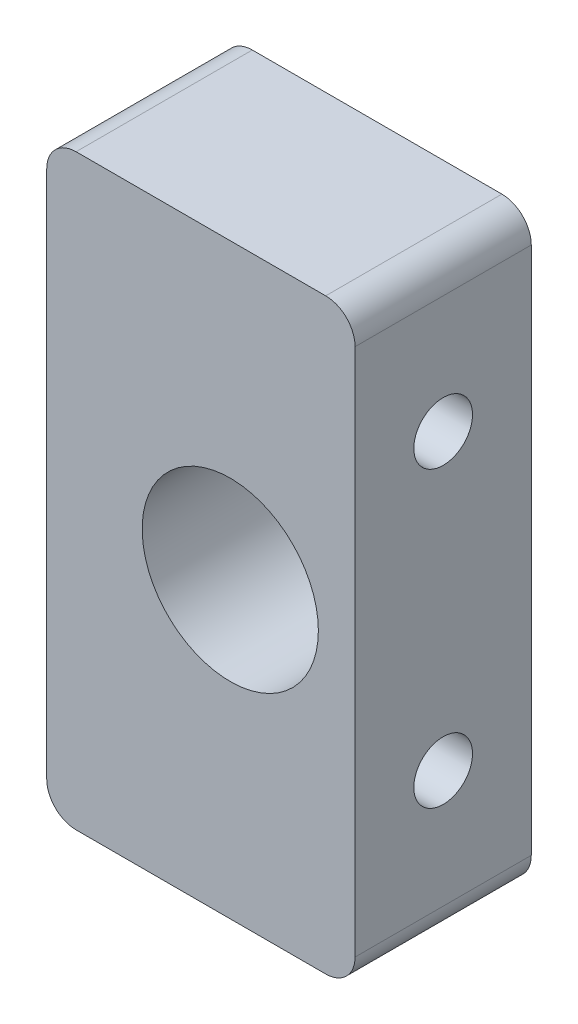
from build123d import *

# Parameters (mm, degrees)
SKETCH1_W           = 21
SKETCH1_H           = 40
BOSS_EXTRUDE1_DEPTH = 12
CUT_EXTRUDE1_REACH  = 48.744
SKETCH2_R           = 6
CUT_EXTRUDE2_REACH  = 48.744
SKETCH3_R           = 2
SKETCH4_R           = 3.75
CUT_EXTRUDE3_DEPTH  = 1.5
FILLET1_R           = 2


with BuildPart() as part:
    # Sketch1 → Boss-Extrude1 (new body)
    with BuildSketch(Plane.XY):
        with Locations((10.5, 20)):
            Rectangle(SKETCH1_W, SKETCH1_H)
    extrude(amount=BOSS_EXTRUDE1_DEPTH)

    # Sketch2 → Cut-Extrude1 (cut, up to next)
    with BuildSketch(Plane.XY.offset(12), mode=Mode.PRIVATE) as cut_extrude1_sk1:
        with Locations((12.5, 20)):
            Circle(SKETCH2_R)
    cut_extrude1_tool1 = extrude(cut_extrude1_sk1.sketch, amount=-CUT_EXTRUDE1_REACH, mode=Mode.PRIVATE) & part.part
    add(cut_extrude1_tool1.solids().sort_by_distance((12.5, 20, 12))[0], mode=Mode.SUBTRACT)

    # Sketch3 → Cut-Extrude2 (cut, up to next)
    with BuildSketch(Plane.ZY, mode=Mode.PRIVATE) as cut_extrude2_sk1:
        with Locations((6, 30)):
            Circle(SKETCH3_R)
    cut_extrude2_tool1 = extrude(cut_extrude2_sk1.sketch, amount=-CUT_EXTRUDE2_REACH, mode=Mode.PRIVATE) & part.part
    # Sketch3 → Cut-Extrude2 (cut, up to next)
    with BuildSketch(Plane.ZY, mode=Mode.PRIVATE) as cut_extrude2_sk2:
        with Locations((6, 10)):
            Circle(SKETCH3_R)
    cut_extrude2_tool2 = extrude(cut_extrude2_sk2.sketch, amount=-CUT_EXTRUDE2_REACH, mode=Mode.PRIVATE) & part.part
    add(cut_extrude2_tool1.solids().sort_by_distance((0, 30, 6))[0], mode=Mode.SUBTRACT)
    add(cut_extrude2_tool2.solids().sort_by_distance((0, 10, 6))[0], mode=Mode.SUBTRACT)

    # Sketch4 → Cut-Extrude3 (cut)
    with BuildSketch(Plane.ZY):
        with Locations((6, 30)):
            Circle(SKETCH4_R)
        with Locations((6, 10)):
            Circle(SKETCH4_R)
    extrude(amount=-CUT_EXTRUDE3_DEPTH, mode=Mode.SUBTRACT)

    # Fillet1
    fillet1_edges = [part.edges().sort_by_distance(p)[0] for p in [
        (0, 40, 6),
        (21, 40, 6),
        (21, 0, 6),
        (0, 0, 6),
    ]]
    fillet(fillet1_edges, radius=FILLET1_R)


solid = part.part
